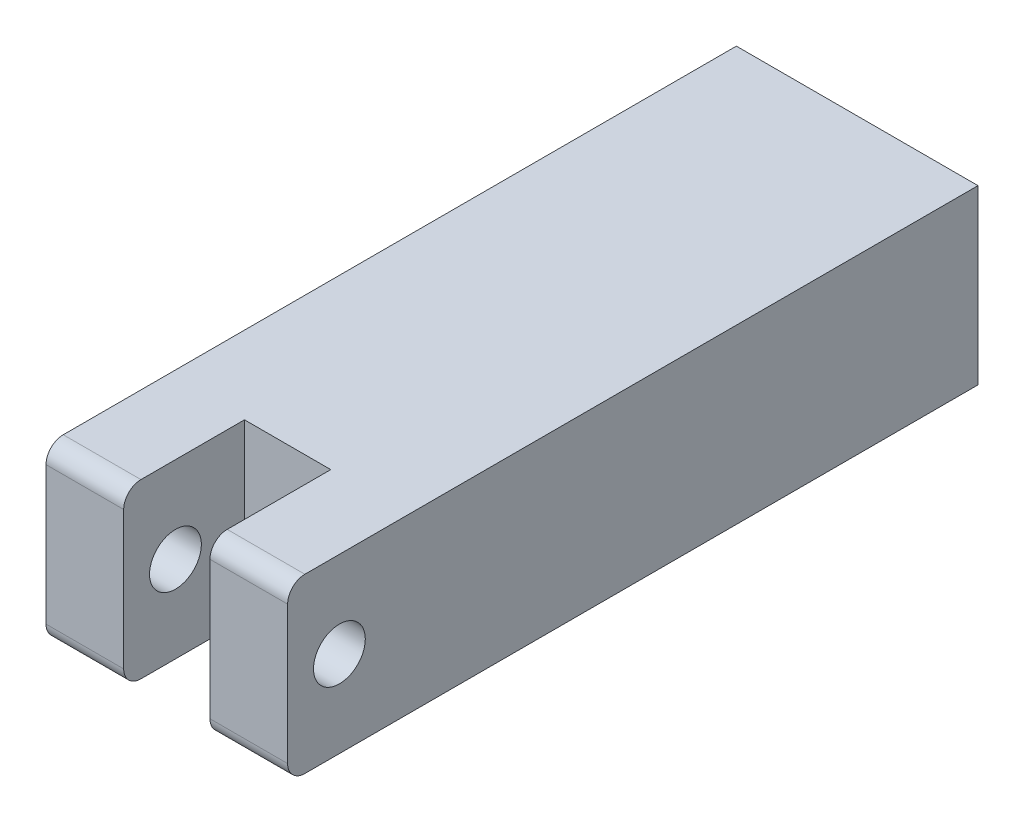
from build123d import *

# Parameters (mm, degrees)
CROQUIS1_R                 = 1.5
SALIENTE_EXTRUIR1_DEPTH    = 7
CORTAR_EXTRUIR1_DEPTH      = 13
CORTAR_EXTRUIR1_DEPTH_BACK = 27.438608133
CROQUIS2_R                 = 1.5
CORTAR_EXTRUIR2_DEPTH      = 27.438608133
CORTAR_EXTRUIR2_DEPTH_BACK = 27.438608133
CROQUIS3_W                 = 5
CROQUIS3_H                 = 7
CORTAR_EXTRUIR3_DEPTH      = 1.5
CROQUIS5_W                 = 3
CROQUIS5_H                 = 6
CORTAR_EXTRUIR4_DEPTH      = 27.438608133


with BuildPart() as part:
    # Croquis1 → Saliente-Extruir1 (new, symmetric)
    with BuildSketch(Plane(origin=(0, 0, 0), x_dir=(0, 0, -1), z_dir=(1, 0, 0))):
        with BuildLine():
            Line((-24, 5), (15, 5))
            Line((15, 5), (15, -5))
            Line((15, -5), (-24, -5))
            ThreePointArc((-24, -5), (-24.707106781, -4.707106781), (-25, -4))
            Line((-25, -4), (-25, 4))
            ThreePointArc((-25, 4), (-24.707106781, 4.707106781), (-24, 5))
        make_face()
        with Locations((-22, 0)):
            Circle(CROQUIS1_R, mode=Mode.SUBTRACT)
    extrude(amount=SALIENTE_EXTRUIR1_DEPTH, both=True)

    # Croquis2 → Cortar-Extruir1 (cut, two sides: drawn at the far end of the back side and taken through both)
    with BuildSketch(Plane.XY.offset(-CORTAR_EXTRUIR1_DEPTH_BACK)):
        with Locations(Location((0, 0, 0), (0, 0, 180))):
            Circle(CROQUIS2_R)
    extrude(amount=CORTAR_EXTRUIR1_DEPTH + CORTAR_EXTRUIR1_DEPTH_BACK, mode=Mode.SUBTRACT)

    # Croquis3 → Cortar-Extruir2 (cut, two sides: drawn at the far end of the back side and taken through both)
    with BuildSketch(Plane(origin=(0, 0, 0), x_dir=(1, 0, 0), z_dir=(0, 1, 0)).offset(-CORTAR_EXTRUIR2_DEPTH_BACK)):
        with Locations((0, -21.5)):
            Rectangle(CROQUIS3_W, CROQUIS3_H)
    extrude(amount=CORTAR_EXTRUIR2_DEPTH + CORTAR_EXTRUIR2_DEPTH_BACK, mode=Mode.SUBTRACT)

    # Croquis4 → Cortar-Extruir3 (cut, symmetric)
    with BuildSketch(Plane.XY):
        Polygon((1.732050808, 3), (-1.732050808, 3), (-3.464101615, 0), (-1.732050808, -3), (1.732050808, -3), (3.464101615, 0), align=None)
    extrude(amount=CORTAR_EXTRUIR3_DEPTH, both=True, mode=Mode.SUBTRACT)

    # Croquis5 → Cortar-Extruir4 (cut, through all)
    with BuildSketch(Plane(origin=(0, 0, 0), x_dir=(0, 0, -1), z_dir=(1, 0, 0))):
        Rectangle(CROQUIS5_W, CROQUIS5_H)
    extrude(amount=-CORTAR_EXTRUIR4_DEPTH, mode=Mode.SUBTRACT)


solid = part.part
